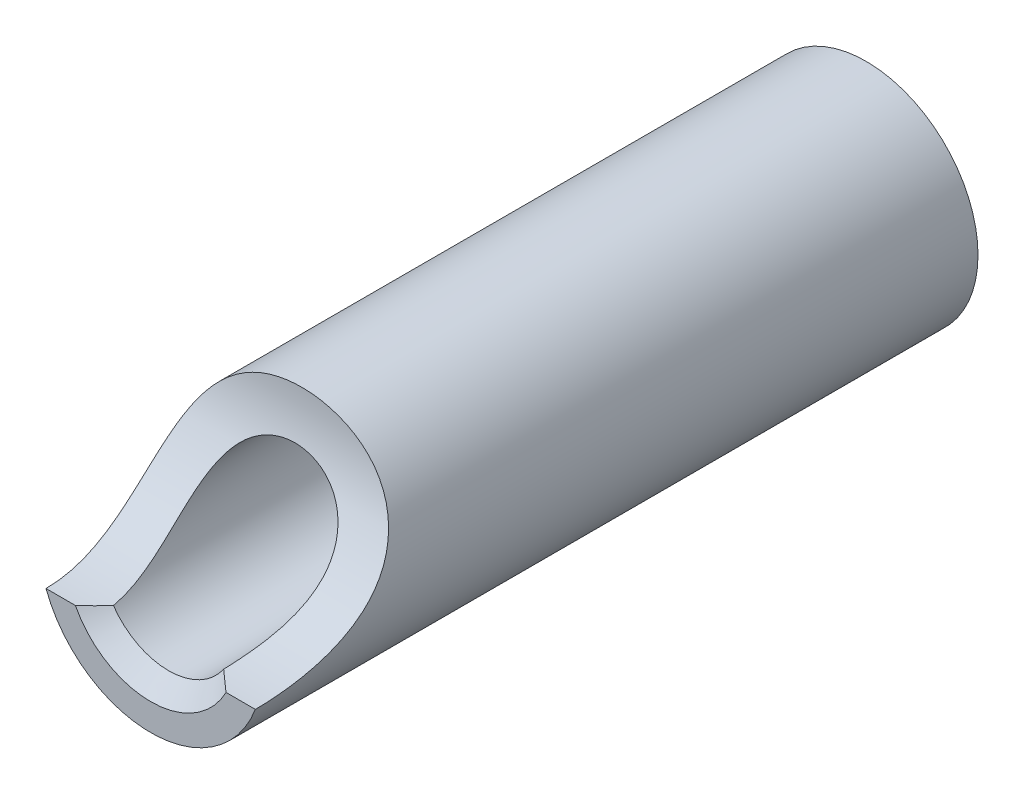
from build123d import *

# Parameters (mm, degrees)
SKETCH2_R             = 7.9375
SKETCH2_R_2           = 4.7625
TUBE_DEPTH            = 50.8
CHAMFER1_SIZE         = 1.27
CURVED_CUT_DEPTH      = 53.025453506
CURVED_CUT_DEPTH_BACK = 53.025453506
SKETCH3_R             = 10.727398282


with BuildPart() as part:
    # Sketch2 → tube (new body)
    with BuildSketch(Plane.XY):
        Circle(SKETCH2_R)
        Circle(SKETCH2_R_2, mode=Mode.SUBTRACT)
    extrude(amount=TUBE_DEPTH)

    # Chamfer1
    chamfer1_edges = [part.edges().sort_by_distance(p)[0] for p in [
        (-4.7625, 0, 0),
        (-4.7625, 0, 50.8),
    ]]
    chamfer(chamfer1_edges, length=CHAMFER1_SIZE)

    # Sketch3 → curved_cut (cut, two sides: drawn at the far end of the back side and taken through both)
    with BuildSketch(Plane(origin=(0, 0, 0), x_dir=(0, 0, -1), z_dir=(1, 0, 0)).offset(-CURVED_CUT_DEPTH_BACK)):
        with Locations((-50.8, 7.9375)):
            Circle(SKETCH3_R)
    extrude(amount=CURVED_CUT_DEPTH + CURVED_CUT_DEPTH_BACK, mode=Mode.SUBTRACT)


solid = part.part
